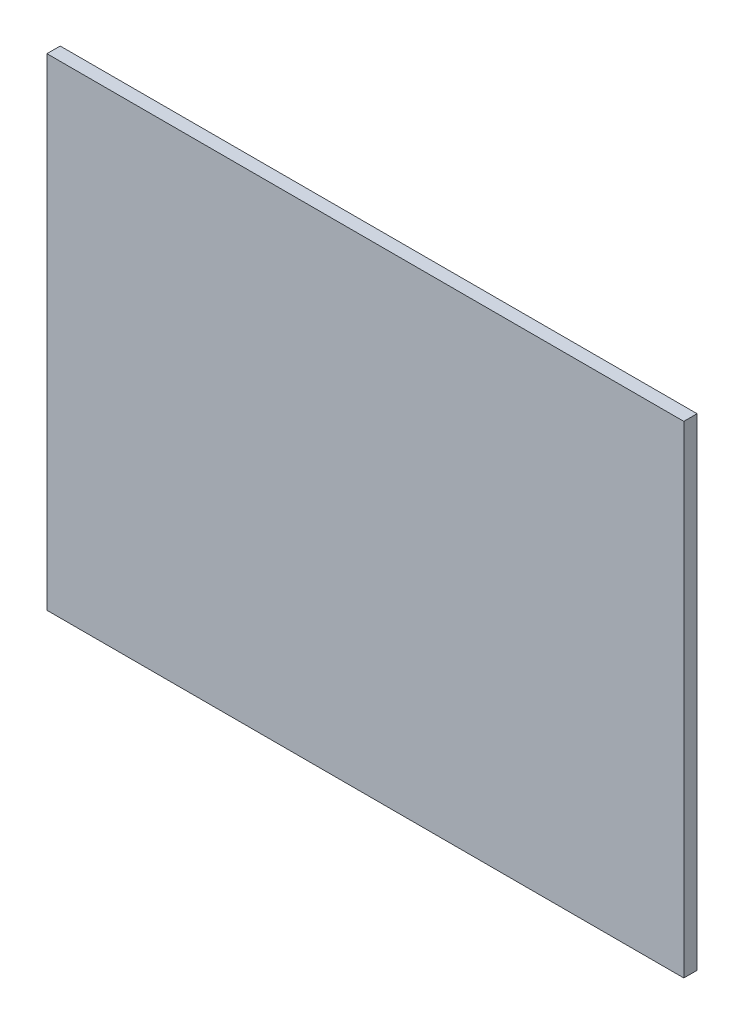
from build123d import *

# Parameters (mm, degrees)
SKETCH1_W           = 914.4
SKETCH1_H           = 19.05
BOSS_EXTRUDE1_DEPTH = 692.15


with BuildPart() as part:
    # Sketch1 → Boss-Extrude1 (new body)
    with BuildSketch(Plane(origin=(0, 0, 0), x_dir=(1, 0, 0), z_dir=(0, 1, 0))):
        with Locations((0, 288.925)):
            Rectangle(SKETCH1_W, SKETCH1_H)
    extrude(amount=BOSS_EXTRUDE1_DEPTH)


solid = part.part
